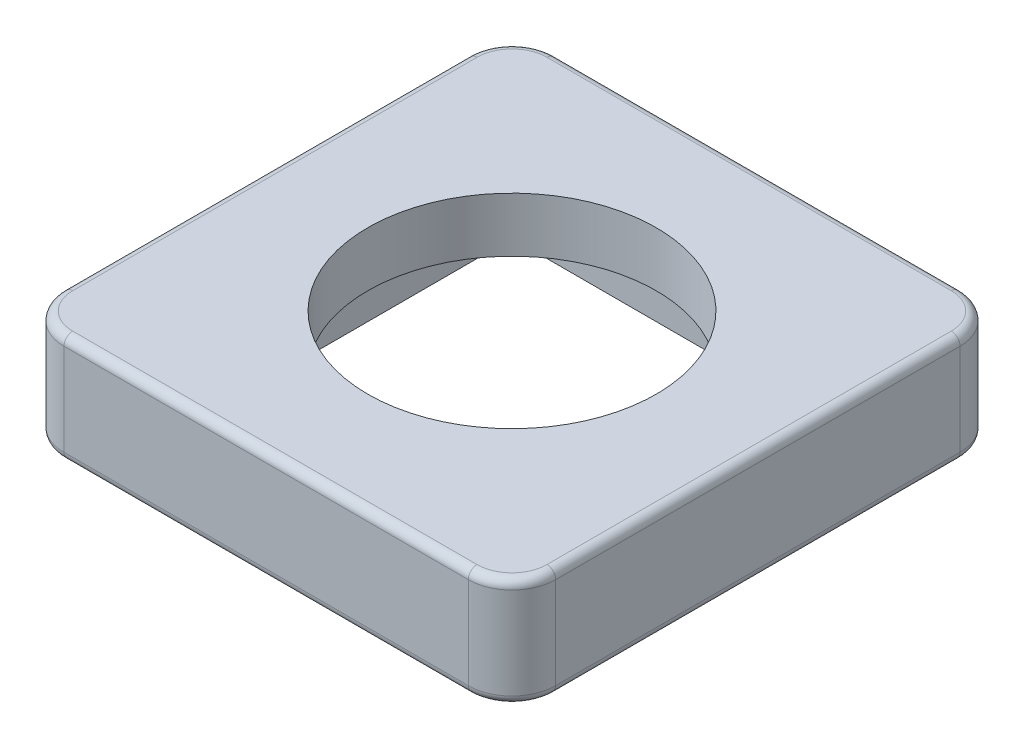
from build123d import *

# Parameters (mm, degrees)
SKETCH1_W           = 57.15
SKETCH1_H           = 57.15
BOSS_EXTRUDE2_DEPTH = 12.7
FILLET1_R           = 5.08
FILLET2_R           = 1.016
SKETCH15_R          = 16.764
CUT_EXTRUDE1_DEPTH  = 6.35
SKETCH16_W          = 40
SKETCH16_H          = 40
CUT_EXTRUDE2_DEPTH  = 6.35


with BuildPart() as part:
    # Sketch1 → Boss-Extrude2 (new body)
    with BuildSketch(Plane(origin=(0, 0, 0), x_dir=(1, 0, 0), z_dir=(0, 1, 0))):
        Rectangle(SKETCH1_W, SKETCH1_H)
    extrude(amount=BOSS_EXTRUDE2_DEPTH)

    # Fillet1
    fillet1_edges = [part.edges().sort_by_distance(p)[0] for p in [
        (28.575, 6.35, 28.575),
        (-28.575, 6.35, 28.575),
        (-28.575, 6.35, -28.575),
        (28.575, 6.35, -28.575),
    ]]
    fillet(fillet1_edges, radius=FILLET1_R)

    # Fillet2
    fillet2_edges = [part.edges().sort_by_distance(p)[0] for p in [
        (0, 0, 28.575),
        (0, 12.7, 28.575),
        (28.575, 0, 0),
        (-28.575, 0, 0),
        (0, 0, -28.575),
        (-27.087102448, 0, -27.087102448),
        (27.087102448, 0, -27.087102448),
        (27.087102448, 0, 27.087102448),
        (-27.087102448, 0, 27.087102448),
        (-28.575, 12.7, 0),
        (28.575, 12.7, 0),
        (0, 12.7, -28.575),
        (-27.087102448, 12.7, -27.087102448),
        (27.087102448, 12.7, -27.087102448),
        (27.087102448, 12.7, 27.087102448),
        (-27.087102448, 12.7, 27.087102448),
    ]]
    fillet(fillet2_edges, radius=FILLET2_R)

    # Sketch15 → Cut-Extrude1 (cut)
    with BuildSketch(Plane(origin=(0, 12.7, 0), x_dir=(1, 0, 0), z_dir=(0, 1, 0))):
        with Locations(Location((0, 0, 0), (0, 0, 270))):
            Circle(SKETCH15_R)
    extrude(amount=-CUT_EXTRUDE1_DEPTH, mode=Mode.SUBTRACT)

    # Sketch16 → Cut-Extrude2 (cut)
    with BuildSketch(Plane.XZ):
        Rectangle(SKETCH16_W, SKETCH16_H)
    extrude(amount=-CUT_EXTRUDE2_DEPTH, mode=Mode.SUBTRACT)


solid = part.part
